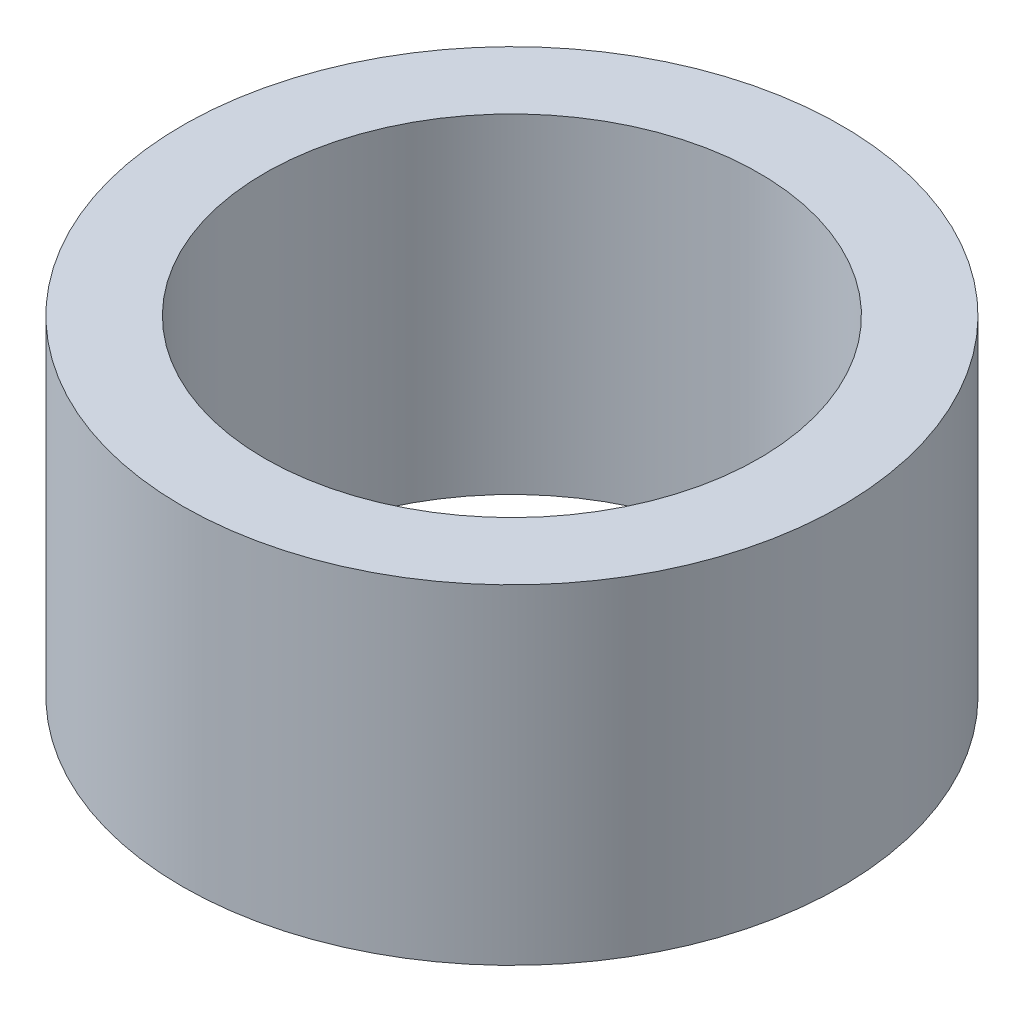
from build123d import *

# Parameters (mm, degrees)
SKETCH1_R           = 40
SKETCH1_R_2         = 30
BOSS_EXTRUDE1_DEPTH = 40


with BuildPart() as part:
    # Sketch1 → Boss-Extrude1 (new body)
    with BuildSketch(Plane(origin=(0, 0, 0), x_dir=(1, 0, 0), z_dir=(0, 1, 0))):
        with Locations(Location((0, 0, 0), (0, 0, 270))):
            Circle(SKETCH1_R)
        with Locations(Location((0, 0, 0), (0, 0, 270))):
            Circle(SKETCH1_R_2, mode=Mode.SUBTRACT)
    extrude(amount=BOSS_EXTRUDE1_DEPTH)


solid = part.part
